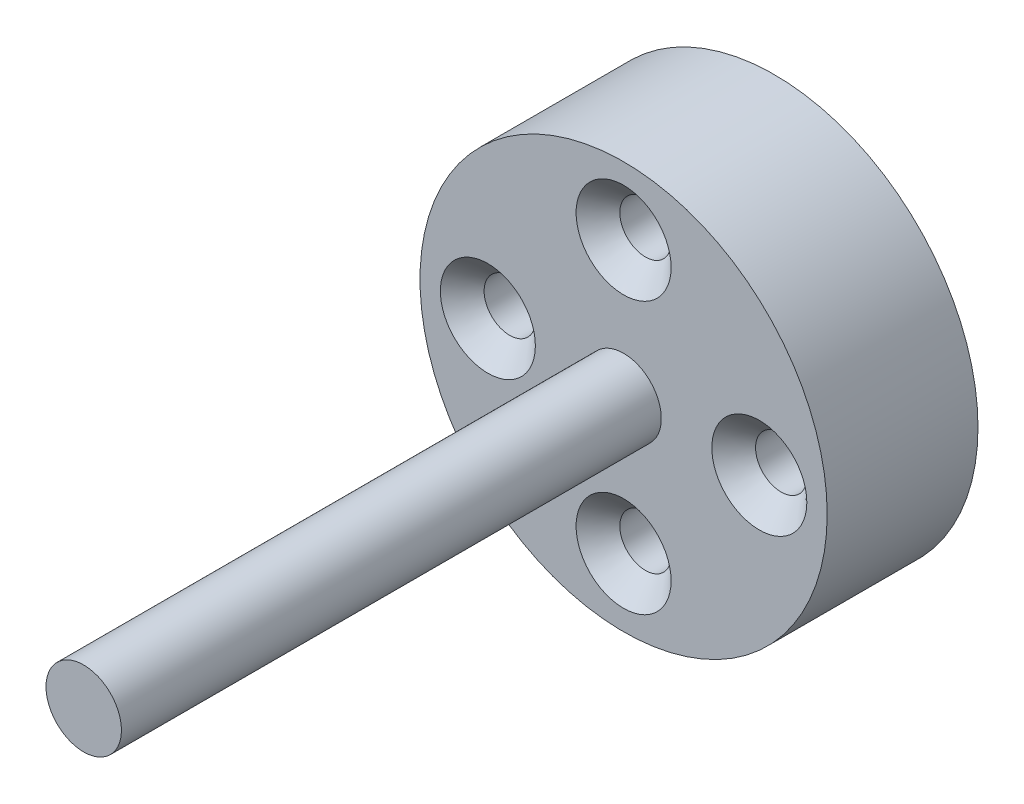
from build123d import *

# Parameters (mm, degrees)
SKETCH1_R                                       = 13.5
SKETCH1_R_2                                     = 1.6
BOSS_EXTRUDE1_DEPTH                             = 10
SKETCH2_R                                       = 2.5
BOSS_EXTRUDE2_DEPTH                             = 35.8
SKETCH3_R                                       = 2.3
CUT_EXTRUDE1_DEPTH                              = 6
CSK_FOR_M3_FLAT_HEAD_MACHINE_SCREW1_D           = 3.4
CSK_FOR_M3_FLAT_HEAD_MACHINE_SCREW1_CSINK_D     = 6.3
CSK_FOR_M3_FLAT_HEAD_MACHINE_SCREW1_CSINK_ANGLE = 90


with BuildPart() as part:
    # Sketch1 → Boss-Extrude1 (new body)
    with BuildSketch(Plane.XY):
        Circle(SKETCH1_R)
        with Locations((0, 9)):
            Circle(SKETCH1_R_2, mode=Mode.SUBTRACT)
        with Locations((0, -9)):
            Circle(SKETCH1_R_2, mode=Mode.SUBTRACT)
        with Locations((-9, 0)):
            Circle(SKETCH1_R_2, mode=Mode.SUBTRACT)
        with Locations((9, 0)):
            Circle(SKETCH1_R_2, mode=Mode.SUBTRACT)
    extrude(amount=BOSS_EXTRUDE1_DEPTH)

    # Sketch2 → Boss-Extrude2 (add)
    with BuildSketch(Plane.XY.offset(10)):
        with Locations(Location((0, 0, 0), (0, 0, 180))):
            Circle(SKETCH2_R)
    extrude(amount=BOSS_EXTRUDE2_DEPTH)

    # Sketch3 → Cut-Extrude1 (cut)
    with BuildSketch(Plane(origin=(0, 0, 0), x_dir=(-1, 0, 0), z_dir=(0, 0, -1))):
        Circle(SKETCH3_R)
    extrude(amount=-CUT_EXTRUDE1_DEPTH, mode=Mode.SUBTRACT)

    # CSK for M3 Flat Head Machine Screw1 (through all)
    with Locations(Plane.XY.offset(10)):
        with Locations((0, 9), (9, 0), (-9, 0), (0, -9)):
            CounterSinkHole(CSK_FOR_M3_FLAT_HEAD_MACHINE_SCREW1_D / 2, CSK_FOR_M3_FLAT_HEAD_MACHINE_SCREW1_CSINK_D / 2, counter_sink_angle=CSK_FOR_M3_FLAT_HEAD_MACHINE_SCREW1_CSINK_ANGLE)


solid = part.part
